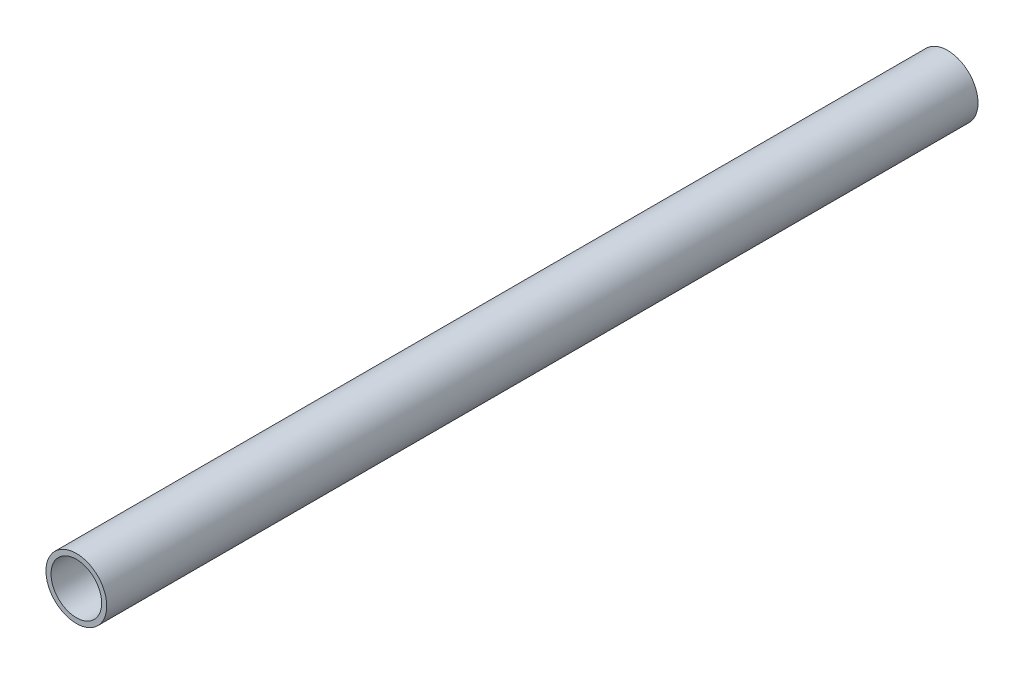
from build123d import *

# Parameters (mm, degrees)
SKETCH1_R           = 6
SKETCH1_R_2         = 5
BOSS_EXTRUDE1_DEPTH = 172


with BuildPart() as part:
    # Sketch1 → Boss-Extrude1 (new body)
    with BuildSketch(Plane.XY):
        Circle(SKETCH1_R)
        Circle(SKETCH1_R_2, mode=Mode.SUBTRACT)
    extrude(amount=BOSS_EXTRUDE1_DEPTH)


solid = part.part
